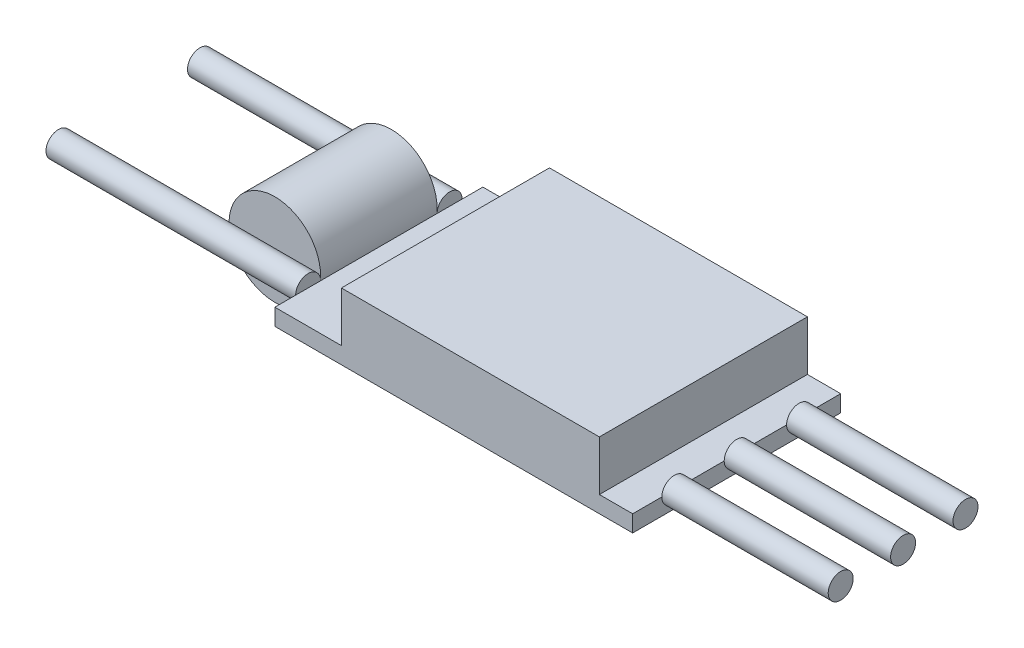
from build123d import *

# Parameters (mm, degrees)
SKETCH1_W           = 43
SKETCH1_H           = 25
BOSS_EXTRUDE1_DEPTH = 2
SKETCH2_R           = 5.5
BOSS_EXTRUDE2_DEPTH = 7
SKETCH3_W           = 31
SKETCH3_H           = 25
BOSS_EXTRUDE3_DEPTH = 6
SKETCH4_R           = 1.5
BOSS_EXTRUDE4_DEPTH = 30
SKETCH5_R           = 1.5
BOSS_EXTRUDE5_DEPTH = 20


with BuildPart() as part:
    # Sketch1 → Boss-Extrude1 (new body)
    with BuildSketch(Plane(origin=(0, 0, 0), x_dir=(1, 0, 0), z_dir=(0, 1, 0))):
        Rectangle(SKETCH1_W, SKETCH1_H)
    extrude(amount=BOSS_EXTRUDE1_DEPTH)

    # Sketch3 → Boss-Extrude3 (add)
    with BuildSketch(Plane(origin=(0, 2, 0), x_dir=(1, 0, 0), z_dir=(0, 1, 0))):
        with Locations((2, 0)):
            Rectangle(SKETCH3_W, SKETCH3_H)
    extrude(amount=BOSS_EXTRUDE3_DEPTH)

    # Sketch4 → Boss-Extrude4 (add)
    with BuildSketch(Plane.ZY.offset(21.5)):
        with Locations((-8.5, 2)):
            Circle(SKETCH4_R)
        with Locations((8.5, 2)):
            Circle(SKETCH4_R)
    extrude(amount=BOSS_EXTRUDE4_DEPTH)

    # Sketch5 → Boss-Extrude5 (add)
    with BuildSketch(Plane(origin=(21.5, 0, 0), x_dir=(0, 0, -1), z_dir=(1, 0, 0))):
        with Locations((-7.5, 2)):
            Circle(SKETCH5_R)
        with Locations((0, 2)):
            Circle(SKETCH5_R)
        with Locations((7.5, 2)):
            Circle(SKETCH5_R)
    extrude(amount=BOSS_EXTRUDE5_DEPTH)


with BuildPart() as body_2:
    # Sketch2 → Boss-Extrude2 (new, symmetric)
    with BuildSketch(Plane.XY):
        with Locations((-27, 2.5)):
            Circle(SKETCH2_R)
    extrude(amount=BOSS_EXTRUDE2_DEPTH, both=True)


solid = Compound([part.part, body_2.part])
